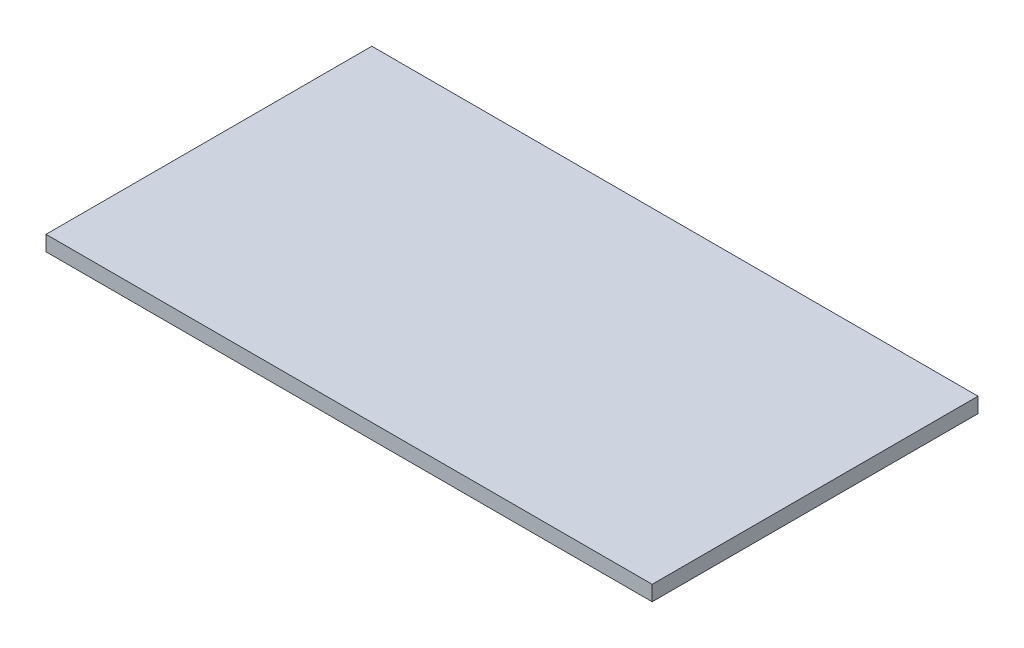
from build123d import *

# Parameters (mm, degrees)
SKETCH1_W           = 80
SKETCH1_H           = 43
BOSS_EXTRUDE1_DEPTH = 2


with BuildPart() as part:
    # Sketch1 → Boss-Extrude1 (new body)
    with BuildSketch(Plane(origin=(0, 0, 0), x_dir=(1, 0, 0), z_dir=(0, 1, 0))):
        Rectangle(SKETCH1_W, SKETCH1_H)
    extrude(amount=BOSS_EXTRUDE1_DEPTH)


solid = part.part
